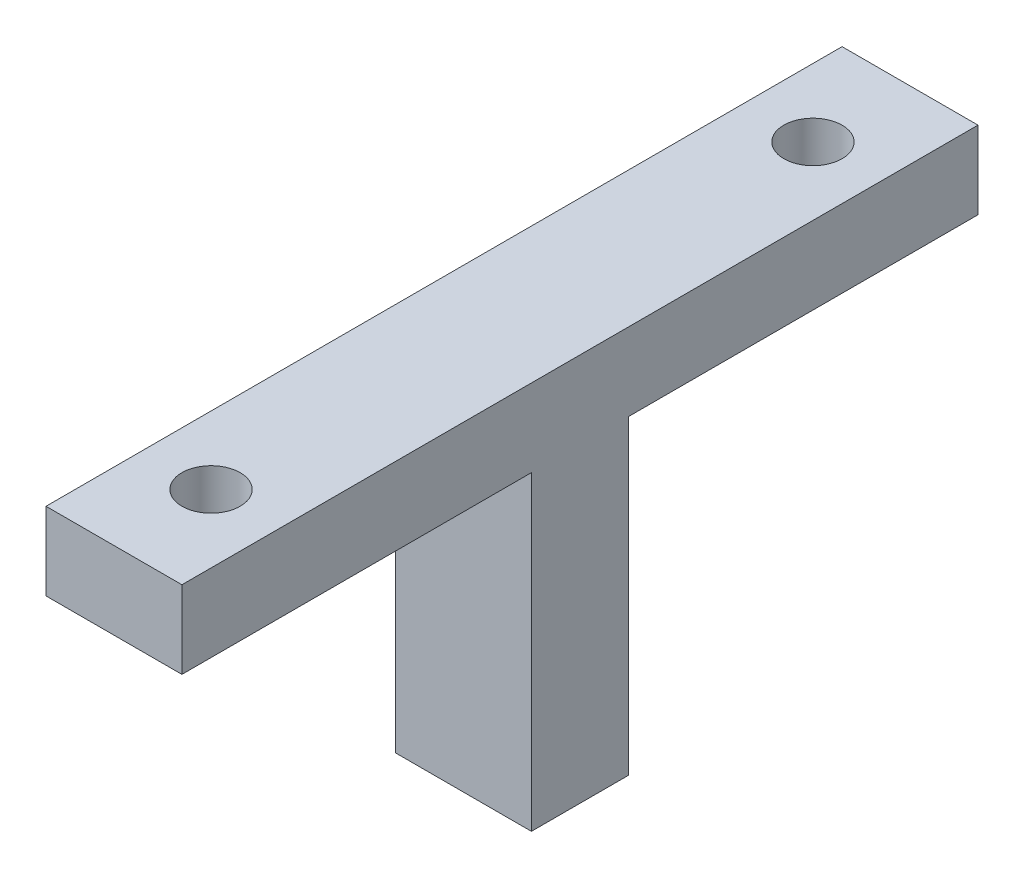
from build123d import *

# Parameters (mm, degrees)
SKETCH1_W             = 7
SKETCH1_H             = 5
BOSS_EXTRUDE1_DEPTH   = 20
SKETCH2_W             = 7
SKETCH2_H             = 4
BOSS_EXTRUDE2_DEPTH   = 18
F_3_0MM_DOWEL_HOLE1_D = 3


with BuildPart() as part:
    # Sketch1 → Boss-Extrude1 (new body)
    with BuildSketch(Plane(origin=(0, 0, 0), x_dir=(1, 0, 0), z_dir=(0, 1, 0))):
        Rectangle(SKETCH1_W, SKETCH1_H)
    extrude(amount=BOSS_EXTRUDE1_DEPTH)

    # Sketch2 → Boss-Extrude2 (add)
    with BuildSketch(Plane.XY.offset(2.5)):
        with Locations((0, 18)):
            Rectangle(SKETCH2_W, SKETCH2_H)
    boss_extrude2 = extrude(amount=BOSS_EXTRUDE2_DEPTH)

    # Ø3.0mm Dowel Hole1 (through all)
    with Locations(Plane(origin=(0, 20, 0), x_dir=(1, 0, 0), z_dir=(0, 1, 0))):
        with Locations((0, -15.5)):
            f_3_0mm_dowel_hole1 = Hole(F_3_0MM_DOWEL_HOLE1_D / 2)

    # Mirror1: Boss-Extrude2, Ø3.0mm Dowel Hole1 across plane
    add(boss_extrude2.mirror(Plane.XY))
    add(f_3_0mm_dowel_hole1.mirror(Plane.XY), mode=Mode.SUBTRACT)


solid = part.part
